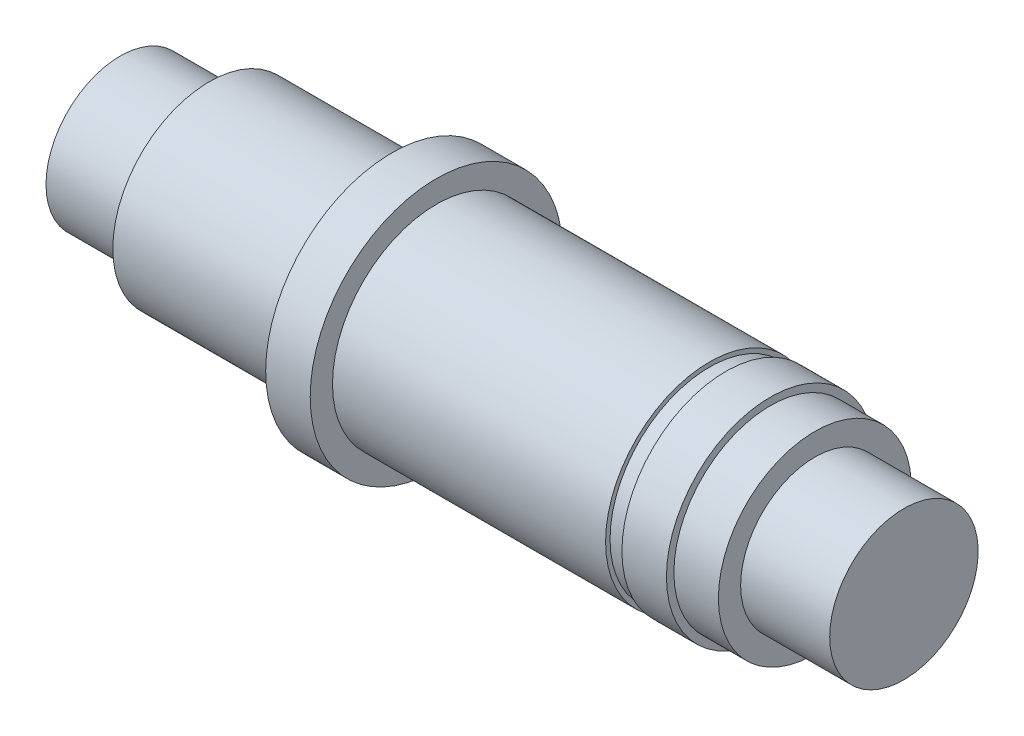
from build123d import *


with BuildPart() as part:
    # Sketch1 → Revolve1 (revolve)
    with BuildSketch(Plane.XY, mode=Mode.PRIVATE) as revolve1_sk:
        Polygon((0, 5), (0, 0), (52.8, 0), (52.8, 5), (46.8, 5), (46.8, 6.5), (43.8, 6.5), (43.8, 7), (40.8, 7), (40.8, 6.7), (39.7, 6.7), (39.7, 7), (21.3, 7), (21.3, 8.5), (18.3, 8.5), (18.3, 6.5), (6, 6.5), (6, 5), align=None)
    revolve(revolve1_sk.sketch.rotate(Axis((-13.668520122, 0, 0), (1, 0, 0)), 90), axis=Axis((-13.668520122, 0, 0), (1, 0, 0)))


solid = part.part
